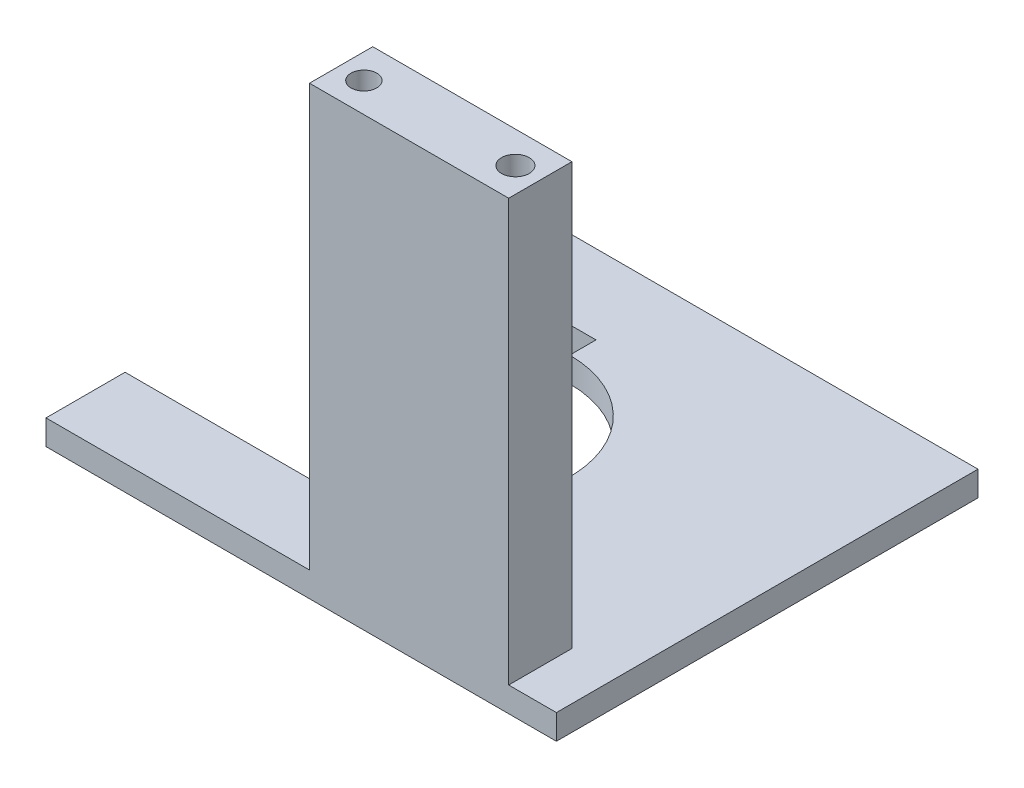
from build123d import *

# Parameters (mm, degrees)
BOSS_EXTRUDE1_DEPTH = 3
SKETCH2_W           = 24
SKETCH2_H           = 7.62
SKETCH2_R           = 1.551597038
SKETCH2_R_2         = 1.664454239
BOSS_EXTRUDE2_DEPTH = 50.8


with BuildPart() as part:
    # Sketch1 → Boss-Extrude1 (new body)
    with BuildSketch(Plane(origin=(0, 0, 0), x_dir=(1, 0, 0), z_dir=(0, 1, 0))):
        with BuildLine():
            Line((0, 0), (61.5, 0))
            Line((61.5, 0), (61.5, -50.8))
            Line((61.5, -50.8), (0, -50.8))
            Line((0, -50.8), (0, -41.275))
            Line((0, -41.275), (25, -41.275))
            Line((25, -41.275), (25, -38.1))
            ThreePointArc((25, -38.1), (37.7, -25.4), (25, -12.7))
            Line((25, -12.7), (25, -9.525))
            Line((25, -9.525), (0, -9.525))
            Line((0, -9.525), (0, 0))
        make_face()
    extrude(amount=BOSS_EXTRUDE1_DEPTH)

    # Sketch2 → Boss-Extrude2 (add)
    with BuildSketch(Plane(origin=(0, 3, 0), x_dir=(1, 0, 0), z_dir=(0, 1, 0))):
        with Locations((43.75, -46.99)):
            Rectangle(SKETCH2_W, SKETCH2_H)
        with Locations(Location((34.75, -47.245142262, 0), (0, 0, 270))):
            Circle(SKETCH2_R, mode=Mode.SUBTRACT)
        with Locations(Location((52.748191643, -46.99, 0), (0, 0, 270))):
            Circle(SKETCH2_R_2, mode=Mode.SUBTRACT)
    extrude(amount=BOSS_EXTRUDE2_DEPTH)


solid = part.part
